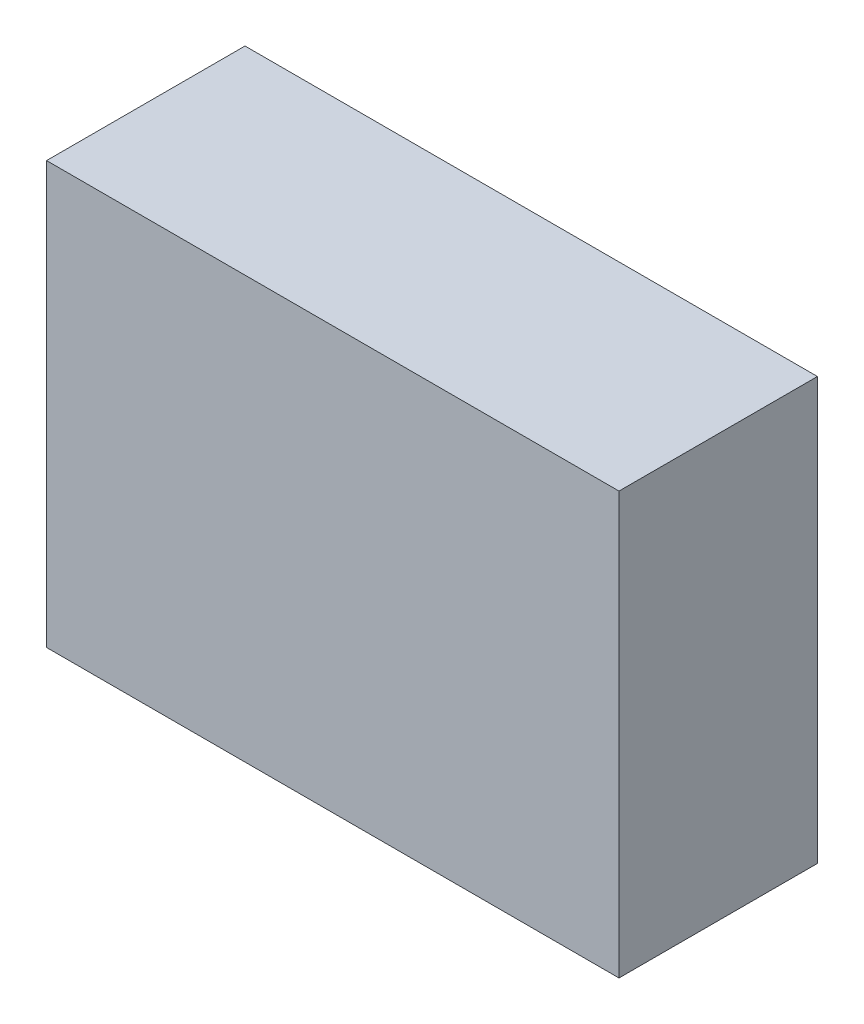
from build123d import *

# Parameters (mm, degrees)
SKETCH1_W               = 13.4131812
SKETCH1_H               = 9.8815398
COMPONENT_OUTLINE_DEPTH = 4.6500034


with BuildPart() as part:
    # Sketch1 → Component_Outline (new body)
    with BuildSketch(Plane.XY):
        with Locations((5.1449986, -0.1147953)):
            Rectangle(SKETCH1_W, SKETCH1_H)
    extrude(amount=COMPONENT_OUTLINE_DEPTH)


solid = part.part
